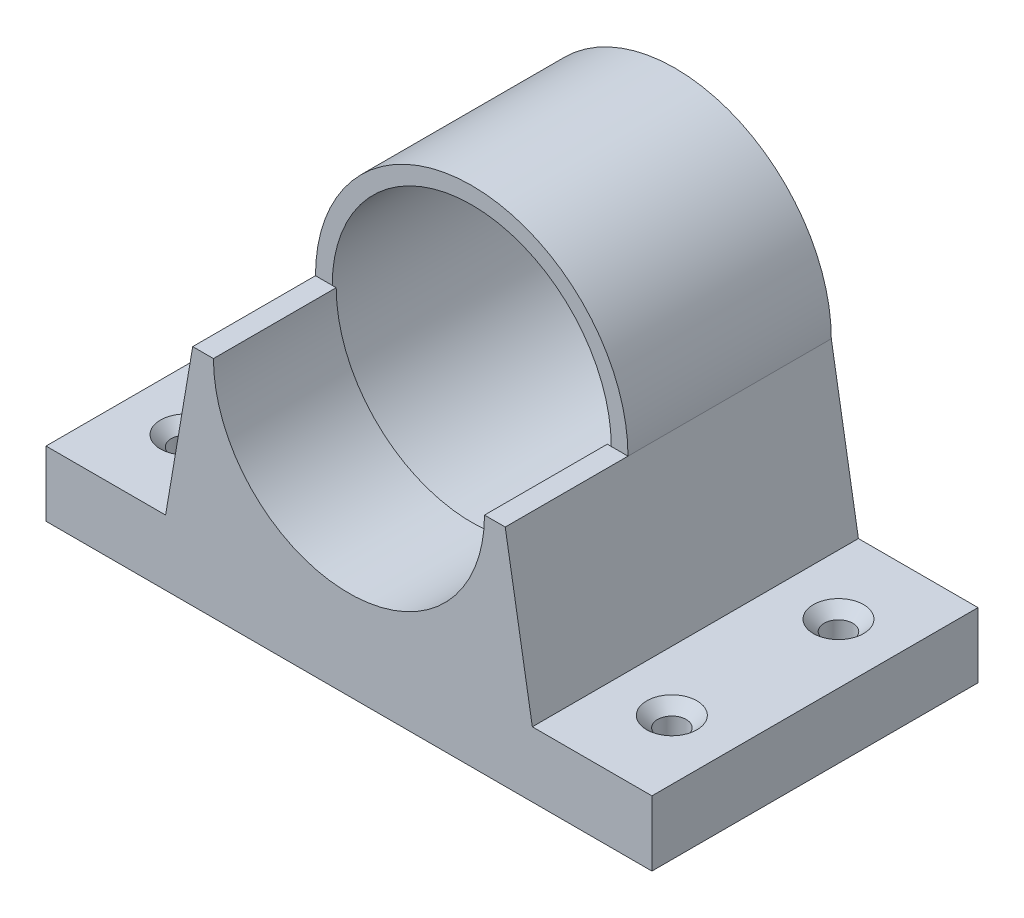
from build123d import *

# Parameters (mm, degrees)
SKETCH1_R                                       = 17.5
BOSS_EXTRUDE9_DEPTH                             = 25.5
BOSS_EXTRUDE10_DEPTH                            = 15.4
BOSS_EXTRUDE10_DEPTH_BACK                       = 25.5
CSK_FOR_M3_FLAT_HEAD_MACHINE_SCREW1_D           = 3.6
CSK_FOR_M3_FLAT_HEAD_MACHINE_SCREW1_CSINK_D     = 6.3
CSK_FOR_M3_FLAT_HEAD_MACHINE_SCREW1_CSINK_ANGLE = 90
CSK_FOR_M3_FLAT_HEAD_MACHINE_SCREW2_D           = 3.6
CSK_FOR_M3_FLAT_HEAD_MACHINE_SCREW2_CSINK_D     = 6.3
CSK_FOR_M3_FLAT_HEAD_MACHINE_SCREW2_CSINK_ANGLE = 90
BOSS_EXTRUDE11_DEPTH                            = 15.4
BOSS_EXTRUDE12_START                            = 3.175
SKETCH15_W                                      = 76
SKETCH15_H                                      = 40.9
SKETCH15_R                                      = 1.8
BOSS_EXTRUDE12_DEPTH                            = 3.175


with BuildPart() as part:
    # Sketch1 → Boss-Extrude9 (new body)
    with BuildSketch(Plane.XY):
        with BuildLine():
            ThreePointArc((-19.6, 18.153395679), (0, 37.753395679), (19.6, 18.153395679))
            ThreePointArc((19.6, 18.153395679), (0, -1.446604321), (-19.6, 18.153395679))
        make_face()
        with Locations((0, 18.153395679)):
            Circle(SKETCH1_R, mode=Mode.SUBTRACT)
    extrude(amount=-BOSS_EXTRUDE9_DEPTH)

    # Sketch1<15> → Boss-Extrude10 (add, two sides: drawn at the far end of the back side and taken through both)
    with BuildSketch(Plane.XY.offset(-BOSS_EXTRUDE10_DEPTH_BACK)):
        with BuildLine():
            Line((-23, -1.846604321), (-38, -1.846604321))
            Line((-38, -1.846604321), (-38, -6.846604321))
            Line((-38, -6.846604321), (38, -6.846604321))
            Line((38, -6.846604321), (38, -1.846604321))
            Line((38, -1.846604321), (23, -1.846604321))
            Line((23, -1.846604321), (19.6, 18.153395679))
            ThreePointArc((19.6, 18.153395679), (0, -1.446604321), (-19.6, 18.153395679))
            Line((-19.6, 18.153395679), (-23, -1.846604321))
        make_face()
    extrude(amount=BOSS_EXTRUDE10_DEPTH + BOSS_EXTRUDE10_DEPTH_BACK)

    # CSK for M3 Flat Head Machine Screw1 (through all)
    with Locations(Plane(origin=(0, -1.846604321, 0), x_dir=(1, 0, 0), z_dir=(0, 1, 0))):
        with Locations((-30.5, 15.5), (-30.5, -5.4)):
            CounterSinkHole(CSK_FOR_M3_FLAT_HEAD_MACHINE_SCREW1_D / 2, CSK_FOR_M3_FLAT_HEAD_MACHINE_SCREW1_CSINK_D / 2, counter_sink_angle=CSK_FOR_M3_FLAT_HEAD_MACHINE_SCREW1_CSINK_ANGLE)

    # CSK for M3 Flat Head Machine Screw2 (through all)
    with Locations(Plane(origin=(0, -1.846604321, 0), x_dir=(1, 0, 0), z_dir=(0, 1, 0))):
        with Locations((30.5, -5.4), (30.5, 15.5)):
            CounterSinkHole(CSK_FOR_M3_FLAT_HEAD_MACHINE_SCREW2_D / 2, CSK_FOR_M3_FLAT_HEAD_MACHINE_SCREW2_CSINK_D / 2, counter_sink_angle=CSK_FOR_M3_FLAT_HEAD_MACHINE_SCREW2_CSINK_ANGLE)

    # Sketch1<19> → Boss-Extrude11 (add)
    with BuildSketch(Plane.XY):
        with BuildLine():
            ThreePointArc((-19.6, 18.153395679), (0, -1.446604321), (19.6, 18.153395679))
            Line((19.6, 18.153395679), (17, 18.153395679))
            ThreePointArc((17, 18.153395679), (0, 1.153395679), (-17, 18.153395679))
            Line((-17, 18.153395679), (-19.6, 18.153395679))
        make_face()
    extrude(amount=BOSS_EXTRUDE11_DEPTH)

    # Sketch15 → Boss-Extrude12 (add)
    with BuildSketch(Plane(origin=(0, -6.846604321, 0), x_dir=(-1, 0, 0), z_dir=(0, -1, 0)).offset(BOSS_EXTRUDE12_START)):
        with Locations((0, 5.05)):
            Rectangle(SKETCH15_W, SKETCH15_H)
        with Locations((-30.5, -5.4)):
            Circle(SKETCH15_R, mode=Mode.SUBTRACT)
        with Locations((30.5, -5.4)):
            Circle(SKETCH15_R, mode=Mode.SUBTRACT)
        with Locations((-30.5, 15.5)):
            Circle(SKETCH15_R, mode=Mode.SUBTRACT)
        with Locations((30.5, 15.5)):
            Circle(SKETCH15_R, mode=Mode.SUBTRACT)
    extrude(amount=-BOSS_EXTRUDE12_DEPTH)


solid = part.part
